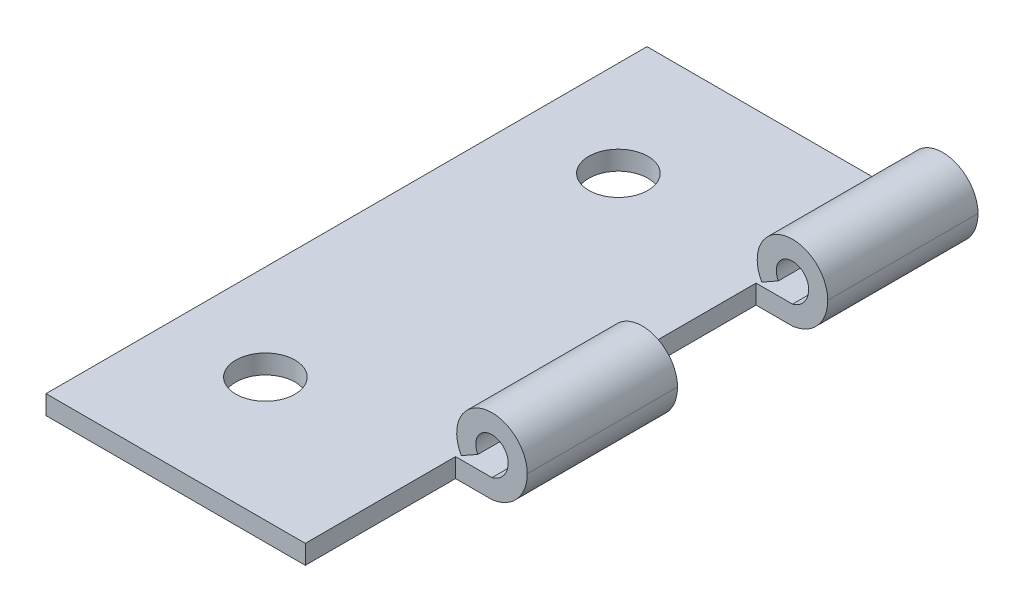
from build123d import *

# Parameters (mm, degrees)
BOSS_EXTRUDE1_DEPTH = 63
SKETCH4_W           = 10.621571424
SKETCH4_H           = 15.75
SKETCH4_R           = 3.1
CUT_EXTRUDE5_DEPTH  = 63


with BuildPart() as part:
    # Sketch3 → Boss-Extrude1 (new body)
    with BuildSketch(Plane.XY):
        with BuildLine():
            Line((0, 0), (31, 0))
            ThreePointArc((31, 0), (33.641651825, 1.402050733), (34.697848077, 4.2))
            ThreePointArc((34.697848077, 4.2), (30.061245163, 7.776705153), (27.778786239, 2.383998263))
            Line((27.778786239, 2.383998263), (29.520996138, 3.366192068))
            ThreePointArc((29.520996138, 3.366192068), (30.568975506, 5.842225922), (32.697848077, 4.2))
            ThreePointArc((32.697848077, 4.2), (32.224028116, 2.810513756), (31, 2))
            Line((31, 2), (28.027781906, 2))
            Line((28.027781906, 2), (0, 2))
            Line((0, 2), (0, 0))
        make_face()
    extrude(amount=-BOSS_EXTRUDE1_DEPTH)

    # Sketch4 → Cut-Extrude5 (cut)
    with BuildSketch(Plane(origin=(0, 12, 0), x_dir=(1, 0, 0), z_dir=(0, 1, 0))):
        with Locations((32.491992857, 39.375)):
            Rectangle(SKETCH4_W, SKETCH4_H)
        with Locations((32.491992857, 7.875)):
            Rectangle(SKETCH4_W, SKETCH4_H)
        with Locations(Location((10, 13, 0), (0, 0, 270))):
            Circle(SKETCH4_R)
        with Locations(Location((10, 50, 0), (0, 0, 270))):
            Circle(SKETCH4_R)
    extrude(amount=-CUT_EXTRUDE5_DEPTH, mode=Mode.SUBTRACT)


solid = part.part
